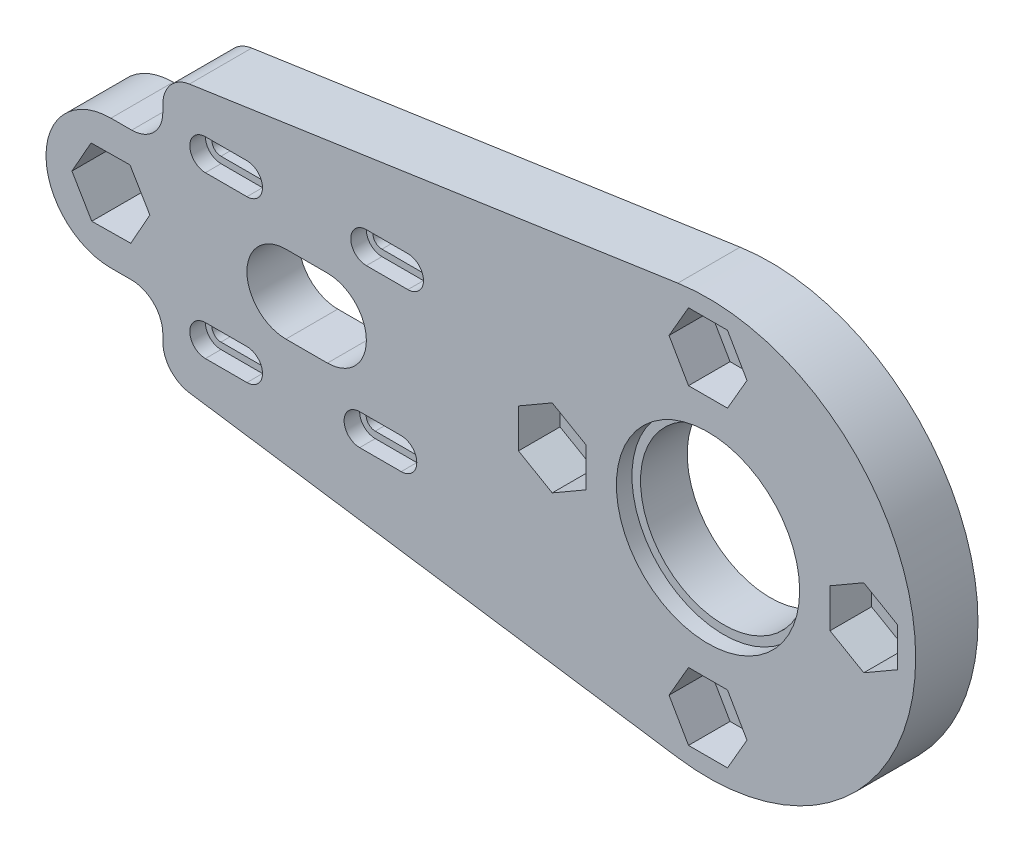
from build123d import *

# Parameters (mm, degrees)
SKETCH2_R               = 10
BOSS_EXTRUDE1_DEPTH     = 12
SKETCH3_R               = 17.65
CUT_EXTRUDE1_DEPTH      = 3
CUT_EXTRUDE2_DEPTH      = 114
CUT_EXTRUDE2_DEPTH_BACK = 114
SKETCH5_R               = 3
CUT_EXTRUDE3_DEPTH      = 114
SKETCH6_R               = 16
CUT_EXTRUDE4_DEPTH      = 113.720894248
SKETCH7_W               = 51
SKETCH7_H               = 43
CUT_EXTRUDE5_DEPTH      = 2
CHAMFER1_SIZE           = 2
CUT_EXTRUDE6_DEPTH      = 8
CUT_EXTRUDE7_DEPTH      = 3
CUT_EXTRUDE8_DEPTH      = 113.720894248
SKETCH11_R              = 3
BOSS_EXTRUDE2_DEPTH     = 12
FILLET1_R               = 6
CUT_EXTRUDE9_DEPTH      = 10


with BuildPart() as part:
    # Sketch2 → Boss-Extrude1 (new body)
    with BuildSketch(Plane.XY):
        with BuildLine():
            Line((-105, -25), (-105, 25))
            Line((-105, 25), (-5.815477401, 39.574994916))
            ThreePointArc((-5.815477401, 39.574994916), (40, 0), (-5.815477401, -39.574994916))
            Line((-5.815477401, -39.574994916), (-105, -25))
        make_face()
        Circle(SKETCH2_R, mode=Mode.SUBTRACT)
    extrude(amount=BOSS_EXTRUDE1_DEPTH)

    # Sketch3 → Cut-Extrude1 (cut)
    with BuildSketch(Plane.XY.offset(12)):
        Circle(SKETCH3_R)
    extrude(amount=-CUT_EXTRUDE1_DEPTH, mode=Mode.SUBTRACT)

    # Sketch4 → Cut-Extrude2 (cut, two sides: drawn at the far end of the back side and taken through both)
    with BuildSketch(Plane.XY.offset(12).offset(-CUT_EXTRUDE2_DEPTH_BACK)):
        with BuildLine():
            Line((-73.3, 7.5), (-81.3, 7.5))
            ThreePointArc((-81.3, 7.5), (-88.8, 0), (-81.3, -7.5))
            Line((-81.3, -7.5), (-73.3, -7.5))
            ThreePointArc((-73.3, -7.5), (-65.8, 0), (-73.3, 7.5))
        make_face()
    extrude(amount=CUT_EXTRUDE2_DEPTH + CUT_EXTRUDE2_DEPTH_BACK, mode=Mode.SUBTRACT)

    # Sketch5 → Cut-Extrude3 (cut, through all)
    with BuildSketch(Plane.XY.offset(12)):
        with Locations((30, 0)):
            Circle(SKETCH5_R)
        with Locations((0, -30)):
            Circle(SKETCH5_R)
        with Locations((-30, 0)):
            Circle(SKETCH5_R)
        with Locations((0, 30)):
            Circle(SKETCH5_R)
    extrude(amount=-CUT_EXTRUDE3_DEPTH, mode=Mode.SUBTRACT)

    # Sketch6 → Cut-Extrude4 (cut, through all)
    with BuildSketch(Plane.XY.offset(9)):
        Circle(SKETCH6_R)
    extrude(amount=-CUT_EXTRUDE4_DEPTH, mode=Mode.SUBTRACT)

    # Sketch7 → Cut-Extrude5 (cut)
    with BuildSketch(Plane(origin=(0, 0, 0), x_dir=(-1, 0, 0), z_dir=(0, 0, -1))):
        with Locations((77.3, 0)):
            Rectangle(SKETCH7_W, SKETCH7_H)
    extrude(amount=-CUT_EXTRUDE5_DEPTH, mode=Mode.SUBTRACT)

    # Chamfer1
    chamfer1_edges = [part.edges().sort_by_distance(p)[0] for p in [
        (-102.8, 21.5, 1),
        (-102.8, -21.5, 1),
        (-51.8, -21.5, 1),
        (-51.8, 21.5, 1),
    ]]
    chamfer(chamfer1_edges, length=CHAMFER1_SIZE)

    # Sketch8 → Cut-Extrude6 (cut)
    with BuildSketch(Plane.XY.offset(12)):
        Polygon((30, -7.505553499), (36.5, -3.75277675), (36.5, 3.75277675), (30, 7.505553499), (23.5, 3.75277675), (23.5, -3.75277675), align=None)
        Polygon((7.505553499, 30), (3.75277675, 36.5), (-3.75277675, 36.5), (-7.505553499, 30), (-3.75277675, 23.5), (3.75277675, 23.5), align=None)
        Polygon((-7.505553499, -30), (-3.75277675, -36.5), (3.75277675, -36.5), (7.505553499, -30), (3.75277675, -23.5), (-3.75277675, -23.5), align=None)
        Polygon((-30, 7.505553499), (-36.5, 3.75277675), (-36.5, -3.75277675), (-30, -7.505553499), (-23.5, -3.75277675), (-23.5, 3.75277675), align=None)
    extrude(amount=-CUT_EXTRUDE6_DEPTH, mode=Mode.SUBTRACT)

    # Sketch9 → Cut-Extrude7 (cut)
    with BuildSketch(Plane.XY.offset(12)):
        with BuildLine():
            Line((-65.8, 12.5), (-57.8, 12.5))
            ThreePointArc((-57.8, 12.5), (-54.8, 15.5), (-57.8, 18.5))
            Line((-57.8, 18.5), (-65.8, 18.5))
            ThreePointArc((-65.8, 18.5), (-68.8, 15.5), (-65.8, 12.5))
        make_face()
        with BuildLine():
            Line((-88.8, 18.5), (-96.8, 18.5))
            ThreePointArc((-96.8, 18.5), (-99.8, 15.5), (-96.8, 12.5))
            Line((-96.8, 12.5), (-88.8, 12.5))
            ThreePointArc((-88.8, 12.5), (-85.8, 15.5), (-88.8, 18.5))
        make_face()
        with BuildLine():
            Line((-59.089545502, -12.5), (-67.089545502, -12.5))
            ThreePointArc((-67.089545502, -12.5), (-70.089545502, -15.5), (-67.089545502, -18.5))
            Line((-67.089545502, -18.5), (-59.089545502, -18.5))
            ThreePointArc((-59.089545502, -18.5), (-56.089545502, -15.5), (-59.089545502, -12.5))
        make_face()
        with BuildLine():
            Line((-88.8, -12.5), (-96.8, -12.5))
            ThreePointArc((-96.8, -12.5), (-99.8, -15.5), (-96.8, -18.5))
            Line((-96.8, -18.5), (-88.8, -18.5))
            ThreePointArc((-88.8, -18.5), (-85.8, -15.5), (-88.8, -12.5))
        make_face()
    extrude(amount=-CUT_EXTRUDE7_DEPTH, mode=Mode.SUBTRACT)

    # Sketch10 → Cut-Extrude8 (cut, through all)
    with BuildSketch(Plane.XY.offset(9)):
        with BuildLine():
            Line((-67.089545502, -13.75), (-59.089545502, -13.75))
            ThreePointArc((-59.089545502, -13.75), (-57.339545502, -15.5), (-59.089545502, -17.25))
            Line((-59.089545502, -17.25), (-67.089545502, -17.25))
            ThreePointArc((-67.089545502, -17.25), (-68.839545502, -15.5), (-67.089545502, -13.75))
        make_face()
        with BuildLine():
            Line((-65.8, 17.25), (-57.8, 17.25))
            ThreePointArc((-57.8, 17.25), (-56.05, 15.5), (-57.8, 13.75))
            Line((-57.8, 13.75), (-65.8, 13.75))
            ThreePointArc((-65.8, 13.75), (-67.55, 15.5), (-65.8, 17.25))
        make_face()
        with BuildLine():
            Line((-96.8, 17.25), (-88.8, 17.25))
            ThreePointArc((-88.8, 17.25), (-87.05, 15.5), (-88.8, 13.75))
            Line((-88.8, 13.75), (-96.8, 13.75))
            ThreePointArc((-96.8, 13.75), (-98.55, 15.5), (-96.8, 17.25))
        make_face()
        with BuildLine():
            Line((-96.8, -13.75), (-88.8, -13.75))
            ThreePointArc((-88.8, -13.75), (-87.05, -15.5), (-88.8, -17.25))
            Line((-88.8, -17.25), (-96.8, -17.25))
            ThreePointArc((-96.8, -17.25), (-98.55, -15.5), (-96.8, -13.75))
        make_face()
    extrude(amount=-CUT_EXTRUDE8_DEPTH, mode=Mode.SUBTRACT)

    # Sketch11 → Boss-Extrude2 (add)
    with BuildSketch(Plane.XY.offset(12)):
        with BuildLine():
            Line((-115, 12.5), (-105, 12.5))
            Line((-105, 12.5), (-105, -12.5))
            Line((-105, -12.5), (-115, -12.5))
            ThreePointArc((-115, -12.5), (-127.5, 0), (-115, 12.5))
        make_face()
        with Locations((-115, 0)):
            Circle(SKETCH11_R, mode=Mode.SUBTRACT)
    extrude(amount=-BOSS_EXTRUDE2_DEPTH)

    # Fillet1
    fillet1_edges = [part.edges().sort_by_distance(p)[0] for p in [
        (-105, -12.5, 6),
        (-105, 12.5, 6),
        (-105, -25, 6),
        (-105, 25, 6),
    ]]
    fillet(fillet1_edges, radius=FILLET1_R)

    # Sketch12 → Cut-Extrude9 (cut)
    with BuildSketch(Plane.XY.offset(12)):
        Polygon((-111.317344252, 6.539983179), (-118.822463699, 6.45926502), (-122.505119447, -0.080718159), (-118.682655748, -6.539983179), (-111.177536301, -6.45926502), (-107.494880553, 0.080718159), align=None)
    extrude(amount=-CUT_EXTRUDE9_DEPTH, mode=Mode.SUBTRACT)


solid = part.part
